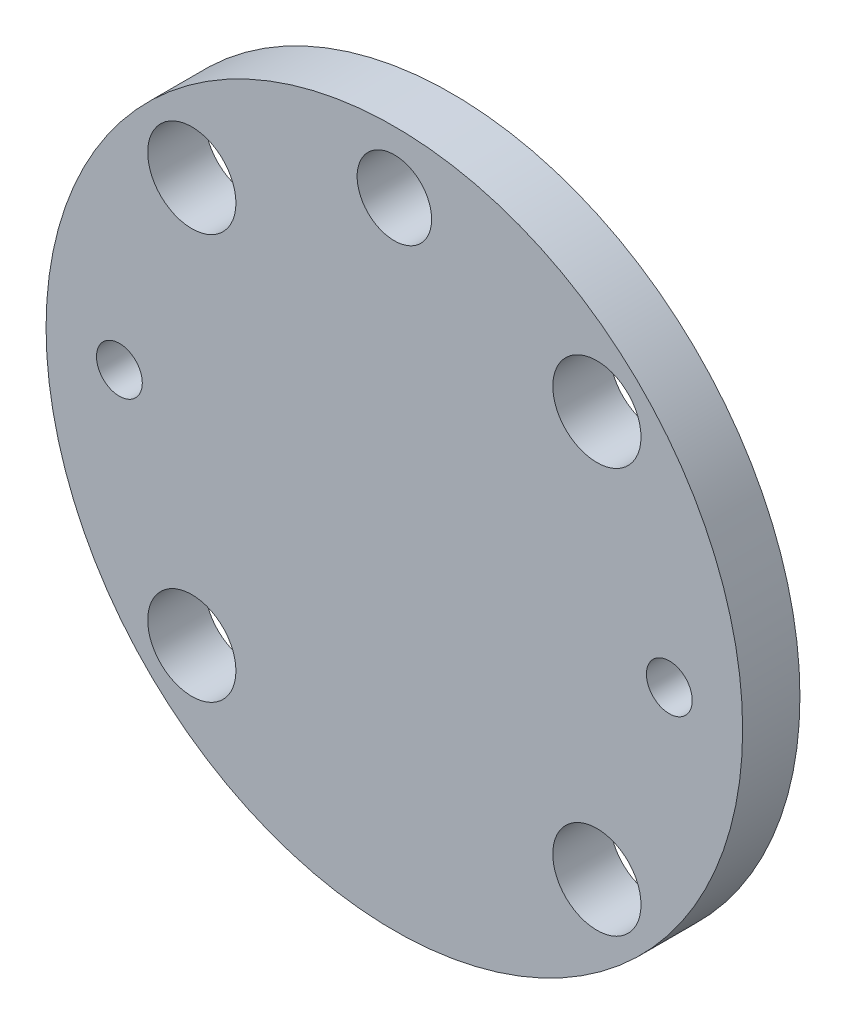
from build123d import *

# Parameters (mm, degrees)
SKETCH1_R           = 3.25
SKETCH1_R_2         = 3.85
SKETCH1_R_3         = 2
BOSS_EXTRUDE1_DEPTH = 5


with BuildPart() as part:
    # Sketch1 → Boss-Extrude1 (new body)
    with BuildSketch(Plane.XY):
        with BuildLine():
            ThreePointArc((0, -30.4), (30.4, 0), (0, 30.4))
            ThreePointArc((0, 30.4), (-30.4, 0), (0, -30.4))
        make_face()
        with Locations((0, 25)):
            Circle(SKETCH1_R, mode=Mode.SUBTRACT)
        with Locations((17.67766953, 17.67766953)):
            Circle(SKETCH1_R_2, mode=Mode.SUBTRACT)
        with Locations((17.67766953, -17.67766953)):
            Circle(SKETCH1_R_2, mode=Mode.SUBTRACT)
        with Locations((-17.67766953, -17.67766953)):
            Circle(SKETCH1_R_2, mode=Mode.SUBTRACT)
        with Locations((-17.67766953, 17.67766953)):
            Circle(SKETCH1_R_2, mode=Mode.SUBTRACT)
        with Locations((24, 0)):
            Circle(SKETCH1_R_3, mode=Mode.SUBTRACT)
        with Locations((-24, 0)):
            Circle(SKETCH1_R_3, mode=Mode.SUBTRACT)
    extrude(amount=BOSS_EXTRUDE1_DEPTH)


solid = part.part
